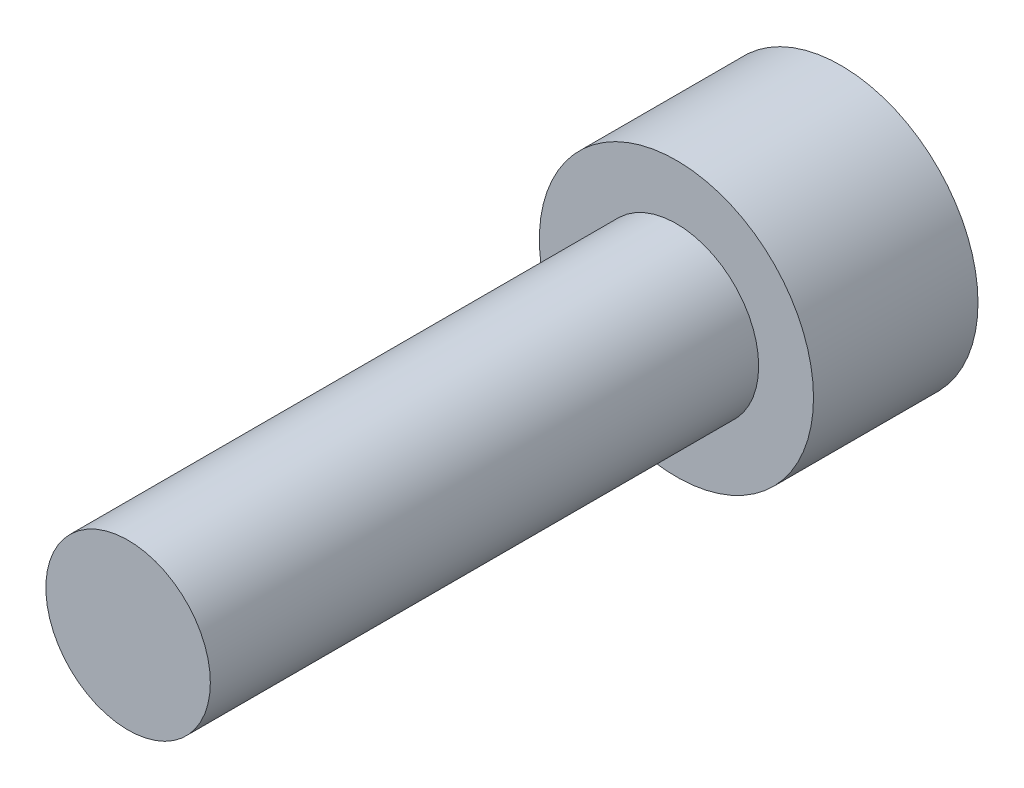
from build123d import *

# Parameters (mm, degrees)
SKETCH_1_R          = 5
EXTRUDE_1_DEPTH     = 6
SKETCH_2_R          = 3
EXTRUDE_2_DEPTH     = 20
CUT_EXTRUDE_1_DEPTH = 3


with BuildPart() as part:
    # ｽｹｯﾁ1 → ﾎﾞｽ - 押し出し1 (new body)
    with BuildSketch(Plane.XY):
        Circle(SKETCH_1_R)
    extrude(amount=EXTRUDE_1_DEPTH)

    # ｽｹｯﾁ2 → ﾎﾞｽ - 押し出し2 (add)
    with BuildSketch(Plane.XY.offset(6)):
        Circle(SKETCH_2_R)
    extrude(amount=EXTRUDE_2_DEPTH)

    # ｽｹｯﾁ3 → ｶｯﾄ - 押し出し1 (cut)
    with BuildSketch(Plane(origin=(0, 0, 0), x_dir=(-1, 0, 0), z_dir=(0, 0, -1))):
        Polygon((2.444628194, 2.36158951), (-0.822882412, 3.297904873), (-3.267510606, 0.936315364), (-2.444628194, -2.36158951), (0.822882412, -3.297904873), (3.267510606, -0.936315364), align=None)
    extrude(amount=-CUT_EXTRUDE_1_DEPTH, mode=Mode.SUBTRACT)


solid = part.part
